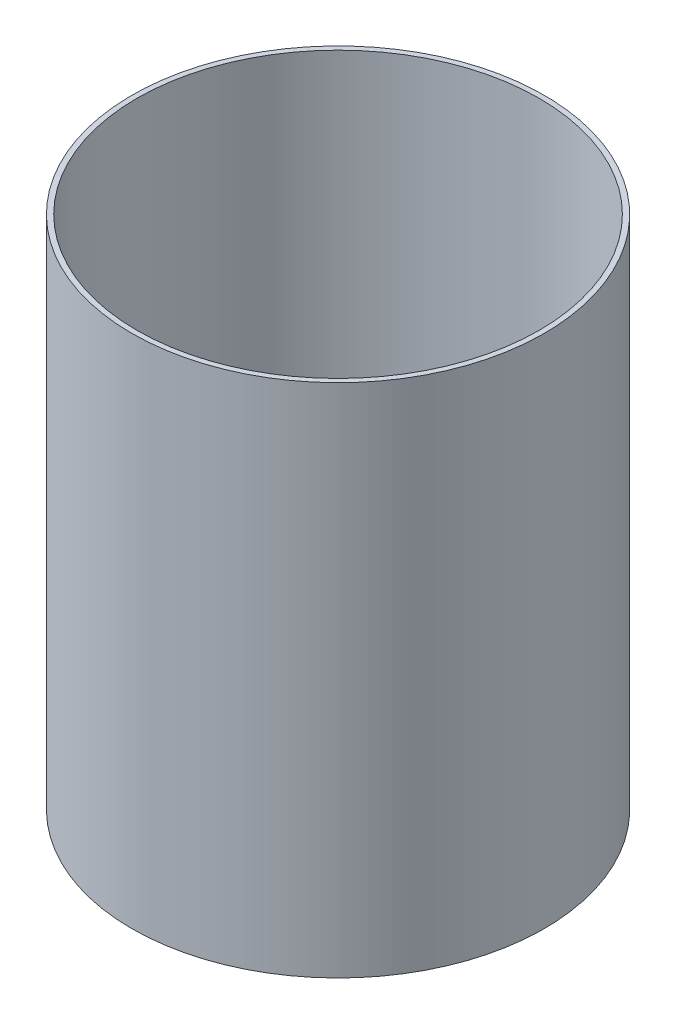
from build123d import *

# Parameters (mm, degrees)
SKETCH1_R           = 101.6
SKETCH1_R_2         = 99.06
BOSS_EXTRUDE1_DEPTH = 254


with BuildPart() as part:
    # Sketch1 → Boss-Extrude1 (new body)
    with BuildSketch(Plane(origin=(0, 0, 0), x_dir=(1, 0, 0), z_dir=(0, 1, 0))):
        with Locations(Location((0, 0, 0), (0, 0, 270))):
            Circle(SKETCH1_R)
        with Locations(Location((0, 0, 0), (0, 0, 270))):
            Circle(SKETCH1_R_2, mode=Mode.SUBTRACT)
    extrude(amount=BOSS_EXTRUDE1_DEPTH)


solid = part.part
